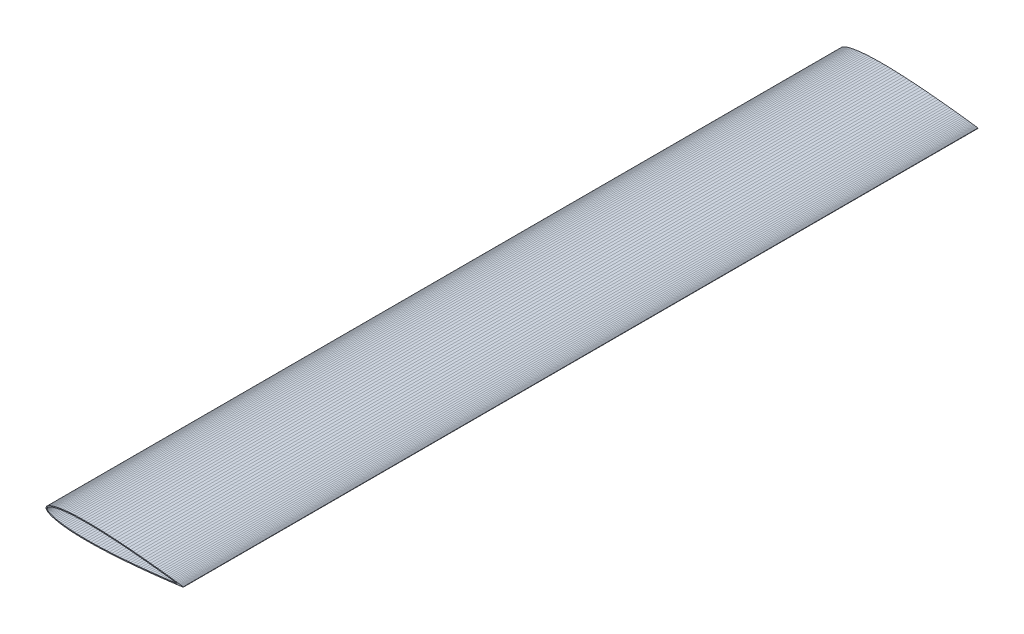
from build123d import *

# Parameters (mm, degrees)
DEFINED_MATERIAL_SECTION_L220_DEPTH = 220


with BuildPart() as part:
    # Sketch1 → Defined_Material_Section_L220 (new body)
    with BuildSketch(Plane.XY):
        Polygon((0.014648311, 0.131798144), (0.058570659, 0.261315293), (0.131699318, 0.388462819), (0.233921529, 0.513127989), (0.365079672, 0.635175162), (0.524971512, 0.754447428), (0.713350507, 0.870768654), (0.92992619, 0.983945901), (1.174364617, 1.09377216), (1.446288882, 1.200029376), (1.745279697, 1.302491672), (2.07087604, 1.400928746), (2.422575866, 1.495109353), (2.799836877, 1.584804829), (3.202077366, 1.669792576), (3.628677107, 1.74985946), (4.078978313, 1.824805064), (4.552286654, 1.894444721), (5.047872321, 1.958612307), (5.564971157, 2.017162727), (6.102785835, 2.069974069), (6.660487082, 2.116949383), (7.237214963, 2.158018085), (7.832080206, 2.193136949), (8.444165573, 2.222290699), (9.07252727, 2.245492185), (9.716196412, 2.262782182), (10.374180505, 2.274228797), (11.045464987, 2.279926536), (11.729014785, 2.279995048), (12.423775916, 2.274577588), (13.128677107, 2.263839237), (13.842631453, 2.24796493), (14.564538087, 2.227157332), (15.293283882, 2.201634611), (16.027745164, 2.171628165), (16.766789448, 2.137380335), (17.509277181, 2.099142161), (18.254063501, 2.057171219), (19, 2.011729576), (19.745936499, 1.963081898), (20.490722819, 1.911493732), (21.233210552, 1.857229997), (21.972254836, 1.800553685), (22.706716118, 1.741724791), (23.435461913, 1.68099947), (24.157368547, 1.618629419), (24.871322893, 1.554861474), (25.576224084, 1.489937411), (26.270985215, 1.424093919), (26.954535013, 1.35756274), (27.625819495, 1.290570928), (28.283803588, 1.223341213), (28.92747273, 1.15609243), (29.555834427, 1.089039979), (30.167919794, 1.022396292), (30.762785037, 0.956371264), (31.339512918, 0.891172633), (31.897214165, 0.827006263), (32.435028843, 0.764076332), (32.952127679, 0.702585376), (33.447713346, 0.642734207), (33.921021687, 0.584721664), (34.371322893, 0.528744218), (34.797922634, 0.474995412), (35.200163123, 0.423665161), (35.577424134, 0.374938901), (35.92912396, 0.328996624), (36.254720303, 0.286011795), (36.553711118, 0.246150205), (36.825635383, 0.20956875), (37.07007381, 0.176414191), (37.286649493, 0.146821911), (37.475028488, 0.120914708), (37.634920328, 0.098801639), (37.766078471, 0.080576958), (37.868300682, 0.06631917), (37.941429341, 0.056090214), (37.985351689, 0.049934814), (38, 0.04788), (38, -0.04788), (37.985351689, -0.049934814), (37.941429341, -0.056090214), (37.868300682, -0.06631917), (37.766078471, -0.080576958), (37.634920328, -0.098801639), (37.475028488, -0.120914708), (37.286649493, -0.146821911), (37.07007381, -0.176414191), (36.825635383, -0.20956875), (36.553711118, -0.246150205), (36.254720303, -0.286011795), (35.92912396, -0.328996624), (35.577424134, -0.374938901), (35.200163123, -0.423665161), (34.797922634, -0.474995412), (34.371322893, -0.528744218), (33.921021687, -0.584721664), (33.447713346, -0.642734207), (32.952127679, -0.702585376), (32.435028843, -0.764076332), (31.897214165, -0.827006263), (31.339512918, -0.891172633), (30.762785037, -0.956371264), (30.167919794, -1.022396292), (29.555834427, -1.089039979), (28.92747273, -1.15609243), (28.283803588, -1.223341213), (27.625819495, -1.290570928), (26.954535013, -1.35756274), (26.270985215, -1.424093919), (25.576224084, -1.489937411), (24.871322893, -1.554861474), (24.157368547, -1.618629419), (23.435461913, -1.68099947), (22.706716118, -1.741724791), (21.972254836, -1.800553685), (21.233210552, -1.857229997), (20.490722819, -1.911493732), (19.745936499, -1.963081898), (19, -2.011729576), (18.254063501, -2.057171219), (17.509277181, -2.099142161), (16.766789448, -2.137380335), (16.027745164, -2.171628165), (15.293283882, -2.201634611), (14.564538087, -2.227157332), (13.842631453, -2.24796493), (13.128677107, -2.263839237), (12.423775916, -2.274577588), (11.729014785, -2.279995048), (11.045464987, -2.279926536), (10.374180505, -2.274228797), (9.716196412, -2.262782182), (9.07252727, -2.245492185), (8.444165573, -2.222290699), (7.832080206, -2.193136949), (7.237214963, -2.158018085), (6.660487082, -2.116949383), (6.102785835, -2.069974069), (5.564971157, -2.017162727), (5.047872321, -1.958612307), (4.552286654, -1.894444721), (4.078978313, -1.824805064), (3.628677107, -1.74985946), (3.202077366, -1.669792576), (2.799836877, -1.584804829), (2.422575866, -1.495109353), (2.07087604, -1.400928746), (1.745279697, -1.302491672), (1.446288882, -1.200029376), (1.174364617, -1.09377216), (0.92992619, -0.983945901), (0.713350507, -0.870768654), (0.524971512, -0.754447428), (0.365079672, -0.635175162), (0.233921529, -0.513127989), (0.131699318, -0.388462819), (0.058570659, -0.261315293), (0.014648311, -0.131798144), (0, 0), align=None)
        Polygon((0.260120577, -0.077209757), (0.287474145, -0.15786929), (0.338114671, -0.245917092), (0.416559552, -0.341584601), (0.525444603, -0.442905894), (0.665656609, -0.547497871), (0.837076908, -0.653347356), (1.039144933, -0.758943249), (1.271148724, -0.863182622), (1.532345731, -0.965248051), (1.822002601, -1.064511663), (2.139401632, -1.160470454), (2.483835507, -1.252705336), (2.854599169, -1.340856038), (3.250982088, -1.424606162), (3.672261904, -1.503674571), (4.117699579, -1.577810715), (4.586535851, -1.64679238), (5.077988773, -1.710424865), (5.591252096, -1.768540996), (6.12549432, -1.821001536), (6.679858269, -1.867695748), (7.253461065, -1.908541913), (7.845394428, -1.943487689), (8.454725236, -1.972510239), (9.080496293, -1.995616069), (9.72172726, -2.012840572), (10.37741574, -2.024247252), (11.046538473, -2.029926643), (11.72805263, -2.029994951), (12.420897198, -2.024592435), (13.123994434, -2.013881565), (13.836251383, -1.998044999), (14.556561449, -1.977283418), (15.28380601, -1.951813275), (16.016856081, -1.921864485), (16.754574, -1.887678119), (17.495815146, -1.849504144), (18.239429685, -1.807599235), (18.984264321, -1.762224717), (19.729164078, -1.713644652), (20.472974075, -1.662124111), (21.214541315, -1.60792765), (21.952716474, -1.55131799), (22.686355686, -1.492554942), (23.414322318, -1.431894547), (24.135488745, -1.369588447), (24.8487381, -1.30588347), (25.552966014, -1.241021418), (26.247082334, -1.175239036), (26.930012818, -1.108768136), (27.600700802, -1.041835852), (28.258108836, -0.974664996), (28.901220296, -0.907474478), (29.529040949, -0.840479762), (30.140600489, -0.773893327), (30.734954029, -0.707925094), (31.311183552, -0.642782802), (31.868399314, -0.57867229), (32.405741208, -0.515797679), (32.922380068, -0.454361422), (33.417518931, -0.394564212), (33.890394244, -0.336604745), (34.340277016, -0.280679314), (34.766473917, -0.226981264), (35.168328319, -0.175700281), (35.545221277, -0.127021559), (35.896572459, -0.081124824), (36.221841003, -0.038183271), (36.508243213, 0), (36.221841003, 0.038183271), (35.896572459, 0.081124824), (35.545221277, 0.127021559), (35.168328319, 0.175700281), (34.766473917, 0.226981264), (34.340277016, 0.280679314), (33.890394244, 0.336604745), (33.417518931, 0.394564212), (32.922380068, 0.454361422), (32.405741208, 0.515797679), (31.868399314, 0.57867229), (31.311183552, 0.642782802), (30.734954029, 0.707925094), (30.140600489, 0.773893327), (29.529040949, 0.840479762), (28.901220296, 0.907474478), (28.258108836, 0.974664996), (27.600700802, 1.041835852), (26.930012818, 1.108768136), (26.247082334, 1.175239036), (25.552966014, 1.241021418), (24.8487381, 1.30588347), (24.135488745, 1.369588447), (23.414322318, 1.431894547), (22.686355686, 1.492554942), (21.952716474, 1.55131799), (21.214541315, 1.60792765), (20.472974075, 1.662124111), (19.729164078, 1.713644652), (18.984264321, 1.762224717), (18.239429685, 1.807599235), (17.495815146, 1.849504144), (16.754574, 1.887678119), (16.016856081, 1.921864485), (15.28380601, 1.951813275), (14.556561449, 1.977283418), (13.836251383, 1.998044999), (13.123994434, 2.013881565), (12.420897198, 2.024592435), (11.72805263, 2.029994951), (11.046538473, 2.029926643), (10.37741574, 2.024247252), (9.72172726, 2.012840572), (9.080496293, 1.995616069), (8.454725236, 1.972510239), (7.845394428, 1.943487689), (7.253461065, 1.908541913), (6.679858269, 1.867695748), (6.12549432, 1.821001536), (5.591252096, 1.768540996), (5.077988773, 1.710424865), (4.586535851, 1.64679238), (4.117699579, 1.577810715), (3.672261904, 1.503674571), (3.250982088, 1.424606162), (2.854599169, 1.340856038), (2.483835507, 1.252705336), (2.139401632, 1.160470454), (1.822002601, 1.064511663), (1.532345731, 0.965248051), (1.271148724, 0.863182622), (1.039144933, 0.758943249), (0.837076908, 0.653347356), (0.665656609, 0.547497871), (0.525444603, 0.442905894), (0.416559552, 0.341584601), (0.338114671, 0.245917092), (0.287474145, 0.15786929), (0.260120577, 0.077209757), (0.251539329, 0), align=None, mode=Mode.SUBTRACT)
    extrude(amount=DEFINED_MATERIAL_SECTION_L220_DEPTH)


solid = part.part
